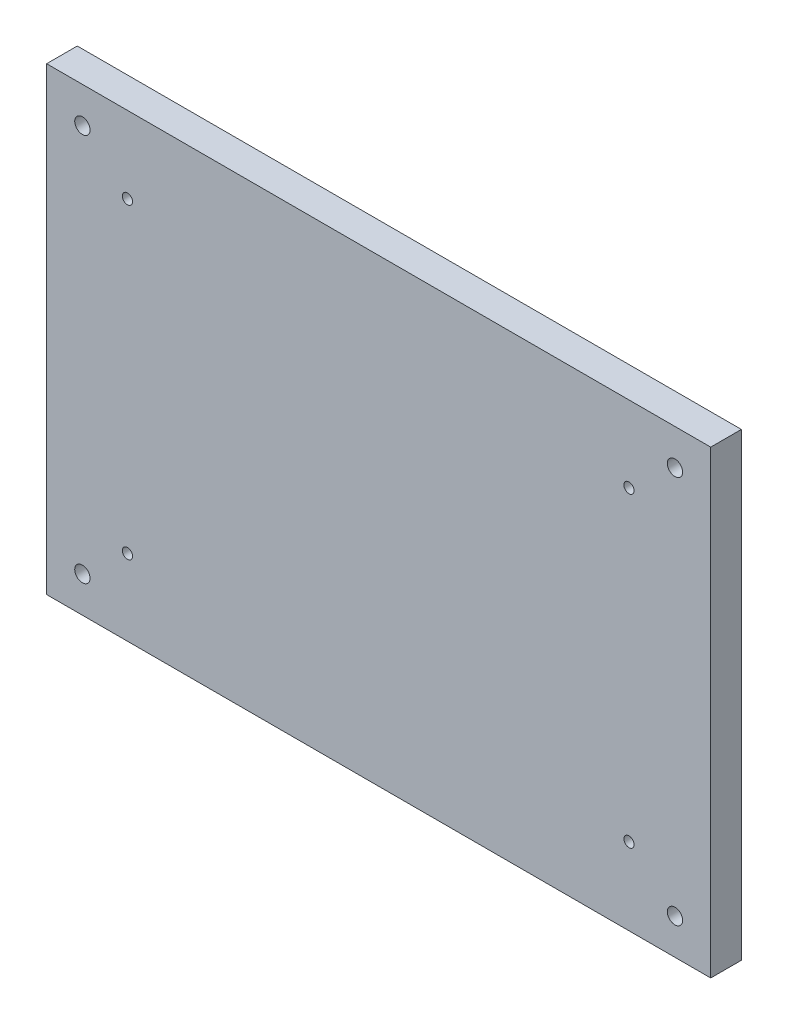
from build123d import *

# Parameters (mm, degrees)
SKETCH1_W             = 130
SKETCH1_H             = 90
BOSS_EXTRUDE1_DEPTH   = 6
F_3_0MM_DOWEL_HOLE1_D = 3
F_2_0MM_DOWEL_HOLE1_D = 2


with BuildPart() as part:
    # Sketch1 → Boss-Extrude1 (new body)
    with BuildSketch(Plane.XY):
        with Locations((65, 45)):
            Rectangle(SKETCH1_W, SKETCH1_H)
    extrude(amount=BOSS_EXTRUDE1_DEPTH)

    # Ø3.0mm Dowel Hole1 (through all)
    with Locations(Plane.XY.offset(6)):
        with Locations((123, 83), (123, 7), (7, 7), (7, 83)):
            Hole(F_3_0MM_DOWEL_HOLE1_D / 2)

    # Ø2.0mm Dowel Hole1 (through all)
    with Locations(Plane(origin=(0, 0, 0), x_dir=(-1, 0, 0), z_dir=(0, 0, -1))):
        with Locations((-114, 75.1), (-114, 15.1), (-15.82, 14.89), (-15.82, 75)):
            Hole(F_2_0MM_DOWEL_HOLE1_D / 2)


solid = part.part
